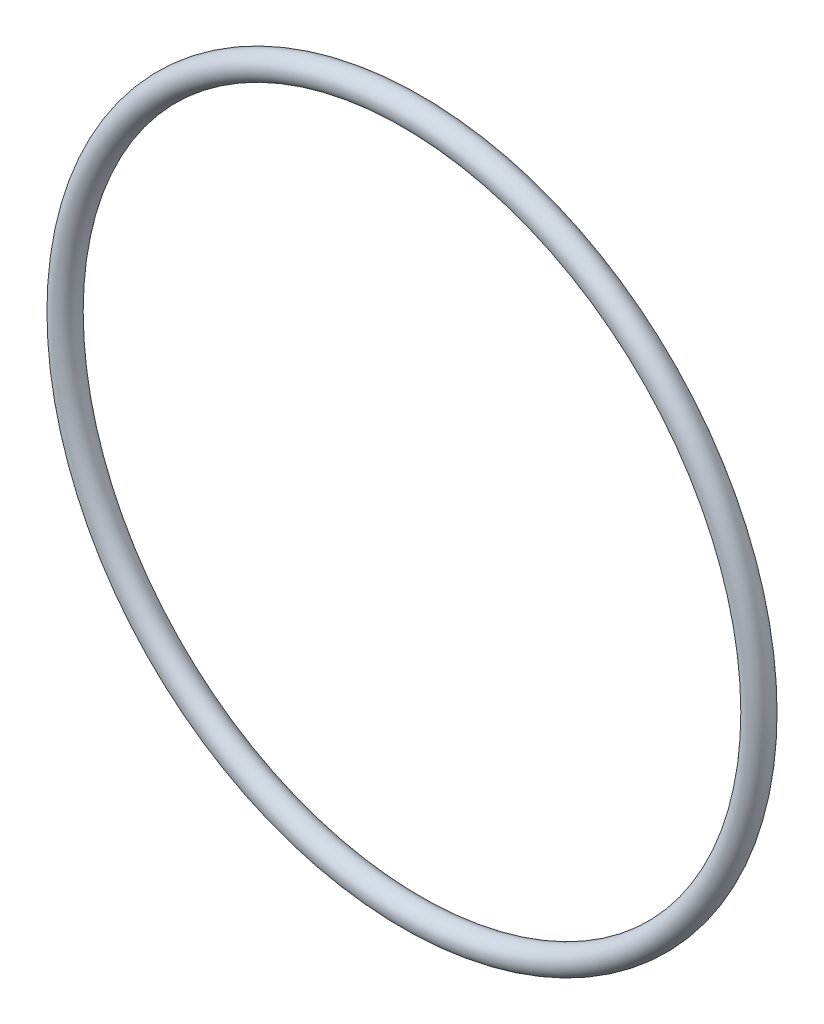
from build123d import *

# Parameters (mm, degrees)
SKETCH2_R = 1.775


with BuildPart() as part:
    # Sweep1: sweep along a path in Sketch1
    with BuildLine(Plane.XY) as sweep1_path:
        CenterArc((0, 0), 46.25, 0, 360)
    # Sketch2 → Sweep1 (sweep)
    with BuildSketch(Plane(origin=(0, 0, 0), x_dir=(1, 0, 0), z_dir=(0, 1, 0))):
        with Locations((-48.025, 0)):
            Circle(SKETCH2_R)
    sweep(path=sweep1_path.line)


solid = part.part
